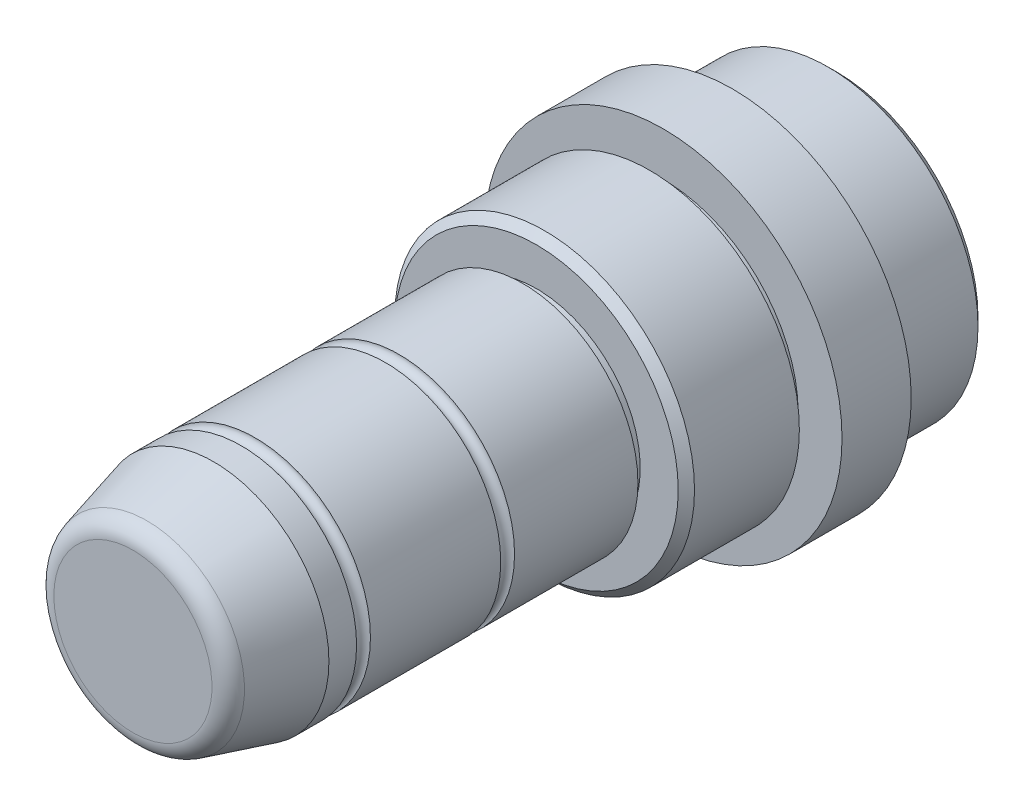
from build123d import *


with BuildPart() as part:
    # Эскиз1 → Повернуть1 (revolve)
    with BuildSketch(Plane.XZ, mode=Mode.PRIVATE) as revolve_1_sk:
        with BuildLine():
            Line((6.858266123, 61), (0, 61))
            Line((0, 61), (0, 0))
            Line((0, 0), (12.292893219, 0))
            Line((12.292893219, 0), (13, 0.707106781))
            Line((13, 0.707106781), (13, 7.8))
            Line((13, 7.8), (11.7, 7.8))
            Line((11.7, 7.8), (11.7, 9))
            Line((11.7, 9), (15.5, 9))
            Line((15.5, 9), (15.5, 15))
            Line((15.5, 15), (11.7, 15))
            Line((11.7, 15), (11.7, 16.2))
            Line((11.7, 16.2), (13, 16.2))
            Line((13, 16.2), (13, 25.292893219))
            Line((13, 25.292893219), (12.292893219, 26))
            Line((12.292893219, 26), (9, 26))
            Line((9, 26), (9, 27.2))
            Line((9, 27.2), (10, 27.2))
            Line((10, 27.2), (10, 37.8999999))
            ThreePointArc((10, 37.8999999), (9.4, 38.4999999), (10, 39.0999999))
            Line((10, 39.0999999), (10, 50.4))
            ThreePointArc((10, 50.4), (9.4, 51), (10, 51.6))
            Line((10, 51.6), (10, 54))
            Line((10, 54), (8.452043736, 59.777051424))
            ThreePointArc((8.452043736, 59.777051424), (7.862722481, 60.659033011), (6.858266123, 61))
        make_face()
    revolve(revolve_1_sk.sketch.rotate(Axis((0, 0, 61.005), (0, 0, -1)), 180), axis=Axis((0, 0, 61.005), (0, 0, -1)))


solid = part.part
